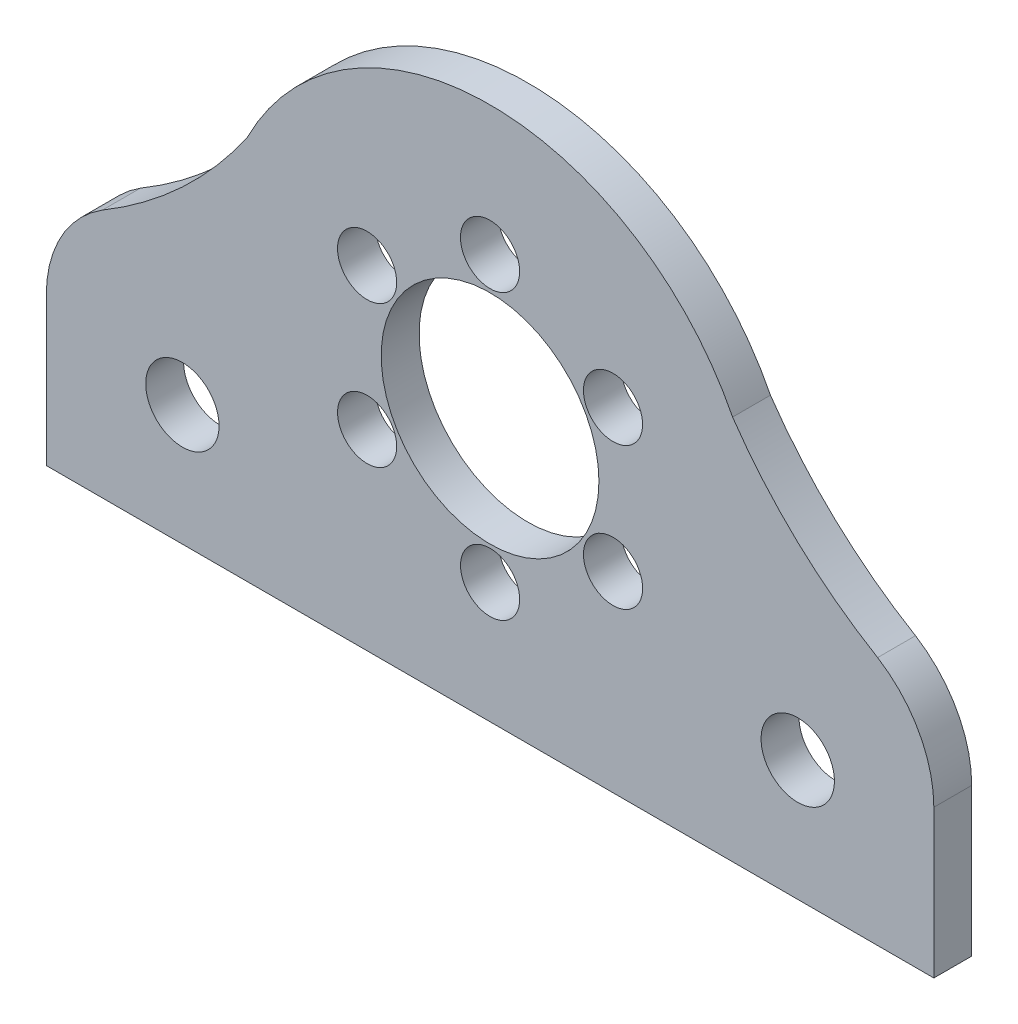
from build123d import *

# Parameters (mm, degrees)
CROQUIS1_R              = 4.6
CROQUIS1_R_2            = 1.249999997
CROQUIS1_R_3            = 1.25
CROQUIS1_R_4            = 1.250000007
CROQUIS1_R_5            = 1.55
SALIENTE_EXTRUIR1_DEPTH = 1.6


with BuildPart() as part:
    # Croquis1 → Saliente-Extruir1 (new body)
    with BuildSketch(Plane.XY):
        with BuildLine():
            Line((-18.75, -11.1), (18.75, -11.1))
            Line((18.75, -11.1), (18.75, -4.852747113))
            ThreePointArc((18.75, -4.852747113), (18.116780108, -2.400965101), (16.375506293, -0.562441789))
            ThreePointArc((16.375506293, -0.562441789), (12.997975085, 1.970224072), (10.247264226, 5.172676757))
            ThreePointArc((10.247264226, 5.172676757), (0, 11.478806947), (-10.247264226, 5.172676757))
            ThreePointArc((-10.247264226, 5.172676757), (-12.997975085, 1.970224072), (-16.375506293, -0.562441789))
            ThreePointArc((-16.375506293, -0.562441789), (-18.116780108, -2.400965101), (-18.75, -4.852747113))
            Line((-18.75, -4.852747113), (-18.75, -11.1))
        make_face()
        Circle(CROQUIS1_R, mode=Mode.SUBTRACT)
        with Locations((-0.0012, 5.99880001)):
            Circle(CROQUIS1_R_2, mode=Mode.SUBTRACT)
        with Locations((5.194513192, 3.000439231)):
            Circle(CROQUIS1_R_3, mode=Mode.SUBTRACT)
        with Locations((5.195713192, -2.998360769)):
            Circle(CROQUIS1_R_3, mode=Mode.SUBTRACT)
        with Locations((0.0012, -5.9988)):
            Circle(CROQUIS1_R_3, mode=Mode.SUBTRACT)
        with Locations((-5.194513192, -3.00043923)):
            Circle(CROQUIS1_R_3, mode=Mode.SUBTRACT)
        with Locations((-5.195713248, 2.998360802)):
            Circle(CROQUIS1_R_4, mode=Mode.SUBTRACT)
        with Locations((13, -6)):
            Circle(CROQUIS1_R_5, mode=Mode.SUBTRACT)
        with Locations((-13, -6)):
            Circle(CROQUIS1_R_5, mode=Mode.SUBTRACT)
    extrude(amount=SALIENTE_EXTRUIR1_DEPTH)


solid = part.part
